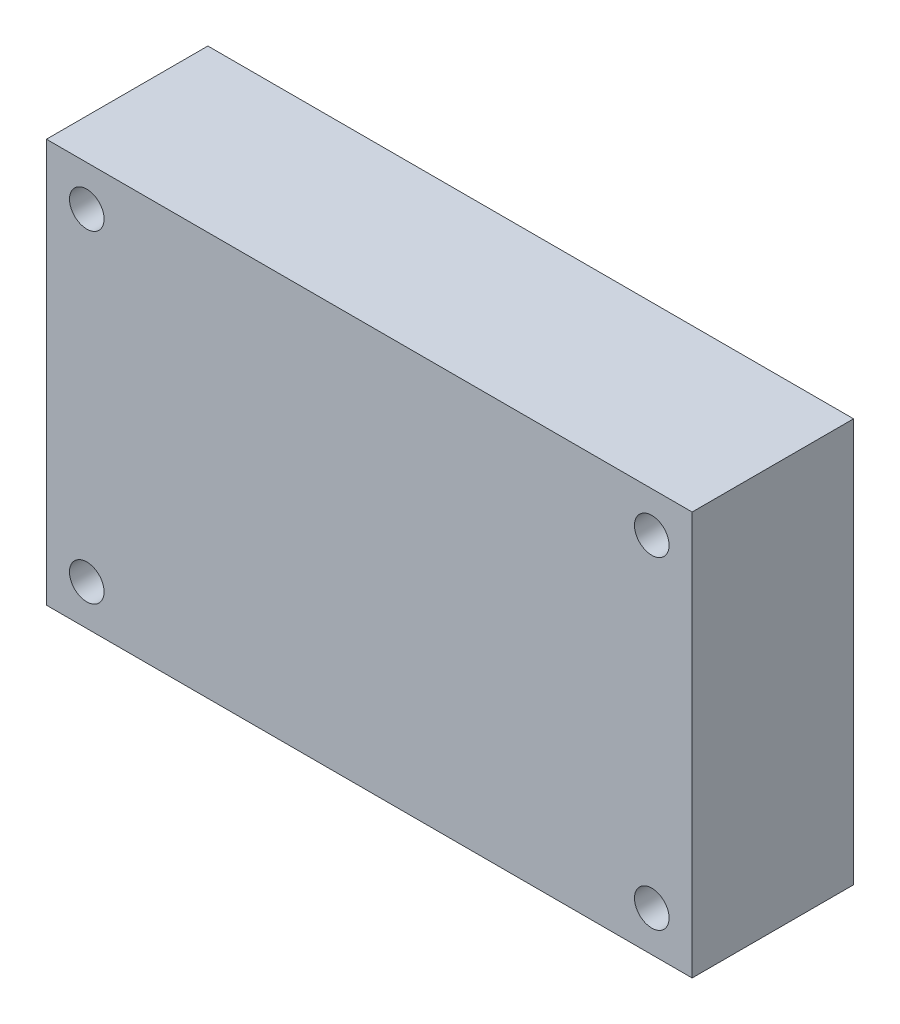
from build123d import *

# Parameters (mm, degrees)
SKETCH1_W           = 56
SKETCH1_H           = 35
BOSS_EXTRUDE1_DEPTH = 14
SKETCH2_R           = 1.5
CUT_EXTRUDE1_DEPTH  = 10


with BuildPart() as part:
    # Sketch1 → Boss-Extrude1 (new body)
    with BuildSketch(Plane.XY):
        with Locations((28, 17.5)):
            Rectangle(SKETCH1_W, SKETCH1_H)
    extrude(amount=BOSS_EXTRUDE1_DEPTH)

    # Sketch2 → Cut-Extrude1 (cut)
    with BuildSketch(Plane.XY.offset(14)):
        with Locations((3.5, 31.5)):
            Circle(SKETCH2_R)
        with Locations((3.5, 3.5)):
            Circle(SKETCH2_R)
        with Locations((52.5, 31.5)):
            Circle(SKETCH2_R)
        with Locations((52.5, 3.5)):
            Circle(SKETCH2_R)
    extrude(amount=-CUT_EXTRUDE1_DEPTH, mode=Mode.SUBTRACT)


solid = part.part
